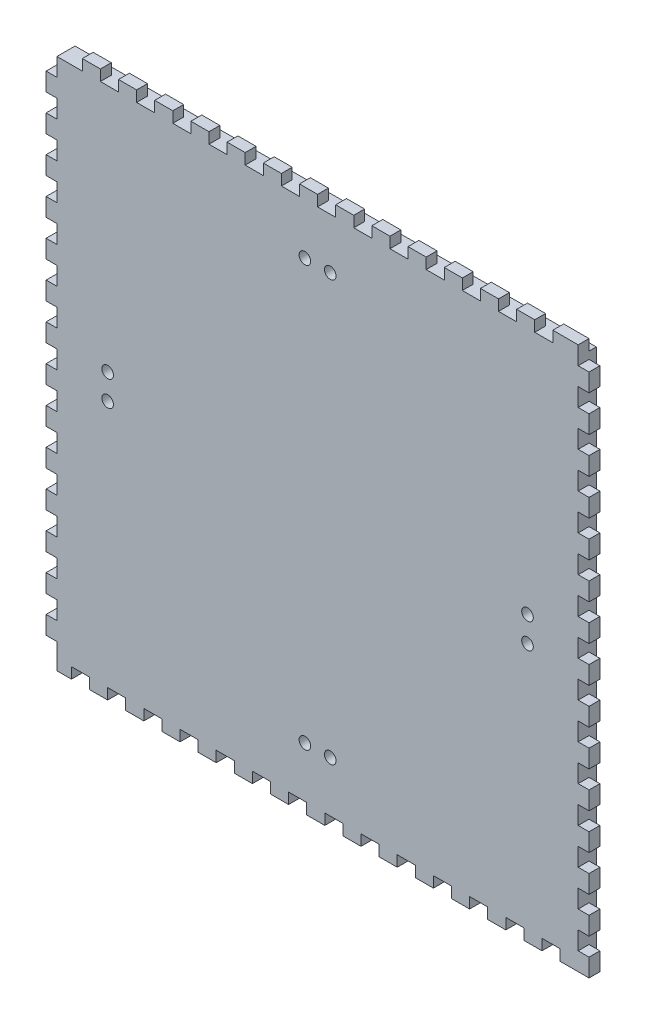
from build123d import *

# Parameters (mm, degrees)
SKETCH1_W               = 150
SKETCH1_H               = 150
BOSS_EXTRUDE1_DEPTH     = 5
SKETCH2_W               = 147
SKETCH2_H               = 2
CUT_EXTRUDE1_DEPTH      = 3
SKETCH3_W               = 5
SKETCH3_H               = 3
CUT_EXTRUDE2_DEPTH      = 3
LPATTERN1_COUNT         = 13
LPATTERN1_PITCH         = 10
SKETCH4_W               = 7
SKETCH4_H               = 3
CUT_EXTRUDE3_DEPTH      = 3
SKETCH5_W               = 5
SKETCH5_H               = 5
CUT_EXTRUDE4_DEPTH      = 3
SKETCH6_W               = 2
SKETCH6_H               = 145
CUT_EXTRUDE5_DEPTH      = 3
SKETCH7_W               = 2
SKETCH7_H               = 147
CUT_EXTRUDE6_DEPTH      = 3
SKETCH8_W               = 3
SKETCH8_H               = 8
CUT_EXTRUDE7_DEPTH      = 3
SKETCH9_W               = 3
SKETCH9_H               = 5
CUT_EXTRUDE8_DEPTH      = 3
LPATTERN2_COUNT         = 13
LPATTERN2_PITCH         = 10
SKETCH10_W              = 3
SKETCH10_H              = 7
CUT_EXTRUDE9_DEPTH      = 3
SKETCH11_W              = 144
SKETCH11_H              = 2
CUT_EXTRUDE10_DEPTH     = 3
SKETCH12_W              = 5
SKETCH12_H              = 3
CUT_EXTRUDE11_DEPTH     = 3
LPATTERN3_COUNT         = 14
LPATTERN3_PITCH         = 10
SKETCH13_R              = 1.6
CUT_EXTRUDE12_DEPTH     = 15
MIRROR2_COPY_1_SKETCH_R = 1.6
MIRROR2_COPY_1_DEPTH    = 15
MIRROR2_COPY_2_SKETCH_R = 1.6
MIRROR2_COPY_2_DEPTH    = 15


with BuildPart() as part:
    # Sketch1 → Boss-Extrude1 (new body)
    with BuildSketch(Plane.XY):
        Rectangle(SKETCH1_W, SKETCH1_H)
    extrude(amount=BOSS_EXTRUDE1_DEPTH)

    # Sketch2 → Cut-Extrude1 (cut)
    with BuildSketch(Plane(origin=(0, 75, 0), x_dir=(1, 0, 0), z_dir=(0, 1, 0))):
        with Locations((-1.5, -1)):
            Rectangle(SKETCH2_W, SKETCH2_H)
    extrude(amount=-CUT_EXTRUDE1_DEPTH, mode=Mode.SUBTRACT)

    # Sketch3 → Cut-Extrude2 (cut)
    with BuildSketch(Plane(origin=(0, 75, 0), x_dir=(1, 0, 0), z_dir=(0, 1, 0))):
        with Locations((-57.5, -3.5)):
            Rectangle(SKETCH3_W, SKETCH3_H)
    cut_extrude2 = extrude(amount=-CUT_EXTRUDE2_DEPTH, mode=Mode.SUBTRACT)

    # LPattern1: Cut-Extrude2 ×13
    with Locations(*[(i * LPATTERN1_PITCH, 0, 0) for i in range(1, LPATTERN1_COUNT)]):
        add(cut_extrude2, mode=Mode.SUBTRACT)

    # Sketch4 → Cut-Extrude3 (cut)
    with BuildSketch(Plane(origin=(0, 75, 0), x_dir=(1, 0, 0), z_dir=(0, 1, 0))):
        with Locations((-68.5, -3.5)):
            Rectangle(SKETCH4_W, SKETCH4_H)
    extrude(amount=-CUT_EXTRUDE3_DEPTH, mode=Mode.SUBTRACT)

    # Sketch5 → Cut-Extrude4 (cut)
    with BuildSketch(Plane(origin=(75, 0, 0), x_dir=(0, 0, -1), z_dir=(1, 0, 0))):
        with Locations((-2.5, 72.5)):
            Rectangle(SKETCH5_W, SKETCH5_H)
        with Locations((-2.5, 62.5)):
            Rectangle(SKETCH5_W, SKETCH5_H)
        with Locations((-2.5, 52.5)):
            Rectangle(SKETCH5_W, SKETCH5_H)
        with Locations((-2.5, 42.5)):
            Rectangle(SKETCH5_W, SKETCH5_H)
        with Locations((-2.5, 32.5)):
            Rectangle(SKETCH5_W, SKETCH5_H)
        with Locations((-2.5, 22.5)):
            Rectangle(SKETCH5_W, SKETCH5_H)
        with Locations((-2.5, 12.5)):
            Rectangle(SKETCH5_W, SKETCH5_H)
        with Locations((-2.5, 2.5)):
            Rectangle(SKETCH5_W, SKETCH5_H)
        with Locations((-2.5, -7.5)):
            Rectangle(SKETCH5_W, SKETCH5_H)
        with Locations((-2.5, -17.5)):
            Rectangle(SKETCH5_W, SKETCH5_H)
        with Locations((-2.5, -27.5)):
            Rectangle(SKETCH5_W, SKETCH5_H)
        with Locations((-2.5, -37.5)):
            Rectangle(SKETCH5_W, SKETCH5_H)
        with Locations((-2.5, -47.5)):
            Rectangle(SKETCH5_W, SKETCH5_H)
        with Locations((-2.5, -57.5)):
            Rectangle(SKETCH5_W, SKETCH5_H)
        with Locations((-2.5, -67.5)):
            Rectangle(SKETCH5_W, SKETCH5_H)
    extrude(amount=-CUT_EXTRUDE4_DEPTH, mode=Mode.SUBTRACT)

    # Sketch6 → Cut-Extrude5 (cut)
    with BuildSketch(Plane(origin=(75, 0, 0), x_dir=(0, 0, -1), z_dir=(1, 0, 0))):
        with Locations((-1, -2.5)):
            Rectangle(SKETCH6_W, SKETCH6_H)
    extrude(amount=-CUT_EXTRUDE5_DEPTH, mode=Mode.SUBTRACT)

    # Sketch7 → Cut-Extrude6 (cut)
    with BuildSketch(Plane.ZY.offset(75)):
        with Locations((1, -1.5)):
            Rectangle(SKETCH7_W, SKETCH7_H)
    extrude(amount=-CUT_EXTRUDE6_DEPTH, mode=Mode.SUBTRACT)

    # Sketch8 → Cut-Extrude7 (cut)
    with BuildSketch(Plane.ZY.offset(75)):
        with Locations((3.5, 71)):
            Rectangle(SKETCH8_W, SKETCH8_H)
    extrude(amount=-CUT_EXTRUDE7_DEPTH, mode=Mode.SUBTRACT)

    # Sketch9 → Cut-Extrude8 (cut)
    with BuildSketch(Plane.ZY.offset(75)):
        with Locations((3.5, 59.5)):
            Rectangle(SKETCH9_W, SKETCH9_H)
    cut_extrude8 = extrude(amount=-CUT_EXTRUDE8_DEPTH, mode=Mode.SUBTRACT)

    # LPattern2: Cut-Extrude8 ×13
    with Locations(*[(0, -i * LPATTERN2_PITCH, 0) for i in range(1, LPATTERN2_COUNT)]):
        add(cut_extrude8, mode=Mode.SUBTRACT)

    # Sketch10 → Cut-Extrude9 (cut)
    with BuildSketch(Plane.ZY.offset(75)):
        with Locations((3.5, -71.5)):
            Rectangle(SKETCH10_W, SKETCH10_H)
    extrude(amount=-CUT_EXTRUDE9_DEPTH, mode=Mode.SUBTRACT)

    # Sketch11 → Cut-Extrude10 (cut)
    with BuildSketch(Plane.XZ.offset(75)):
        with Locations((0, 1)):
            Rectangle(SKETCH11_W, SKETCH11_H)
    extrude(amount=-CUT_EXTRUDE10_DEPTH, mode=Mode.SUBTRACT)

    # Sketch12 → Cut-Extrude11 (cut)
    with BuildSketch(Plane.XZ.offset(75)):
        with Locations((64.5, 3.5)):
            Rectangle(SKETCH12_W, SKETCH12_H)
    cut_extrude11 = extrude(amount=-CUT_EXTRUDE11_DEPTH, mode=Mode.SUBTRACT)

    # LPattern3: Cut-Extrude11 ×14
    with Locations(*[(-i * LPATTERN3_PITCH, 0, 0) for i in range(1, LPATTERN3_COUNT)]):
        add(cut_extrude11, mode=Mode.SUBTRACT)

    # Sketch13 → Cut-Extrude12 (cut)
    with BuildSketch(Plane(origin=(0, 0, 0), x_dir=(-1, 0, 0), z_dir=(0, 0, -1))):
        with Locations((-3.5, 58)):
            Circle(SKETCH13_R)
        with Locations((3.5, 58)):
            Circle(SKETCH13_R)
        with Locations((-58, 3.5)):
            Circle(SKETCH13_R)
        with Locations((-58, -3.5)):
            Circle(SKETCH13_R)
    cut_extrude12 = extrude(amount=-CUT_EXTRUDE12_DEPTH, mode=Mode.SUBTRACT)

    # Mirror1: Cut-Extrude12 across plane
    add(cut_extrude12.mirror(Plane.ZX), mode=Mode.SUBTRACT)

    # Mirror2 copy 1 sketch → Mirror2 copy 1 (cut)
    with BuildSketch(Plane(origin=(0, 0, 0), x_dir=(1, 0, 0), z_dir=(0, 0, -1))):
        with Locations((-3.5, 58)):
            Circle(MIRROR2_COPY_1_SKETCH_R)
        with Locations((3.5, 58)):
            Circle(MIRROR2_COPY_1_SKETCH_R)
        with Locations((-58, 3.5)):
            Circle(MIRROR2_COPY_1_SKETCH_R)
        with Locations((-58, -3.5)):
            Circle(MIRROR2_COPY_1_SKETCH_R)
    extrude(amount=-MIRROR2_COPY_1_DEPTH, mode=Mode.SUBTRACT)

    # Mirror2 copy 2 sketch → Mirror2 copy 2 (cut)
    with BuildSketch(Plane(origin=(0, 0, 0), x_dir=(1, 0, 0), z_dir=(0, 0, -1))):
        with Locations((-3.5, -58)):
            Circle(MIRROR2_COPY_2_SKETCH_R)
        with Locations((3.5, -58)):
            Circle(MIRROR2_COPY_2_SKETCH_R)
        with Locations((-58, -3.5)):
            Circle(MIRROR2_COPY_2_SKETCH_R)
        with Locations((-58, 3.5)):
            Circle(MIRROR2_COPY_2_SKETCH_R)
    extrude(amount=-MIRROR2_COPY_2_DEPTH, mode=Mode.SUBTRACT)


solid = part.part
